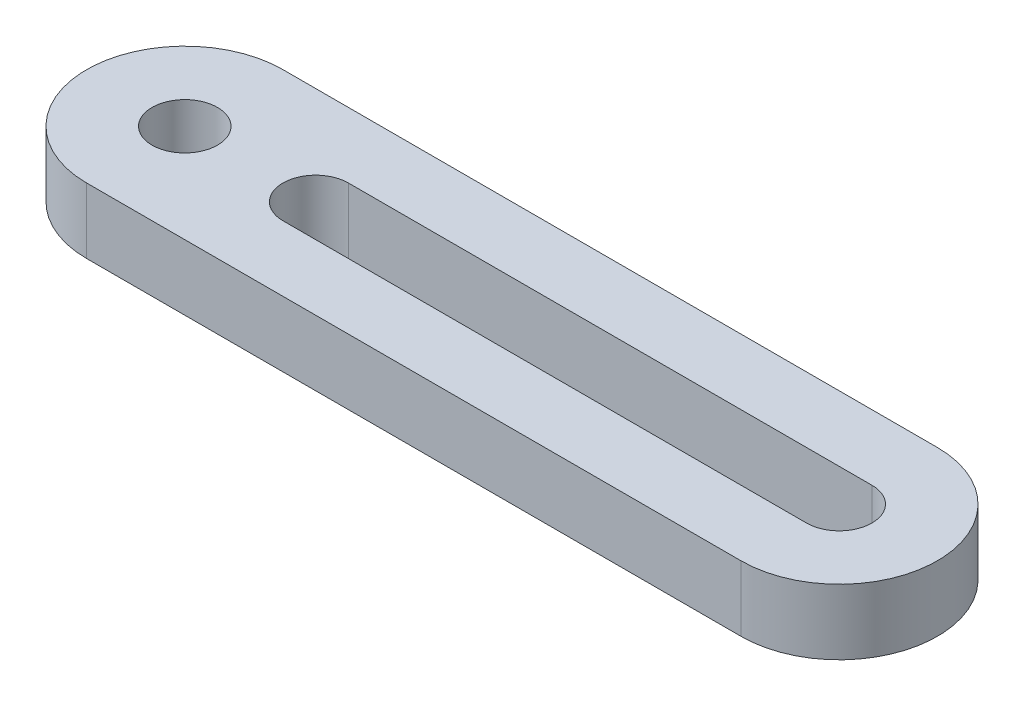
from build123d import *

# Parameters (mm, degrees)
BOSS_EXTRUDE1_DEPTH = 5
SKETCH3_R           = 2.5
CUT_EXTRUDE1_DEPTH  = 5


with BuildPart() as part:
    # Sketch1 → Boss-Extrude1 (new body)
    with BuildSketch(Plane(origin=(0, 0, 0), x_dir=(1, 0, 0), z_dir=(0, 1, 0))):
        with BuildLine():
            Line((-39.418817776, 14.621878605), (10.581182224, 14.621878605))
            ThreePointArc((10.581182224, 14.621878605), (18.081182224, 7.121878605), (10.581182224, -0.378121395))
            Line((10.581182224, -0.378121395), (-39.418817776, -0.378121395))
            ThreePointArc((-39.418817776, -0.378121395), (-46.918817776, 7.121878605), (-39.418817776, 14.621878605))
        make_face()
    extrude(amount=BOSS_EXTRUDE1_DEPTH)

    # Sketch3 → Cut-Extrude1 (cut)
    with BuildSketch(Plane(origin=(0, 5, 0), x_dir=(1, 0, 0), z_dir=(0, 1, 0))):
        with Locations(Location((-39.418817776, 7.121878605, 0), (0, 0, 270))):
            Circle(SKETCH3_R)
        with BuildLine():
            Line((-29.419490327, 9.621878605), (10.581182224, 9.621878605))
            ThreePointArc((10.581182224, 9.621878605), (13.081182224, 7.121878605), (10.581182224, 4.621878605))
            Line((10.581182224, 4.621878605), (-29.419490327, 4.621878605))
            ThreePointArc((-29.419490327, 4.621878605), (-31.919490327, 7.121878605), (-29.419490327, 9.621878605))
        make_face()
    extrude(amount=-CUT_EXTRUDE1_DEPTH, mode=Mode.SUBTRACT)


solid = part.part
